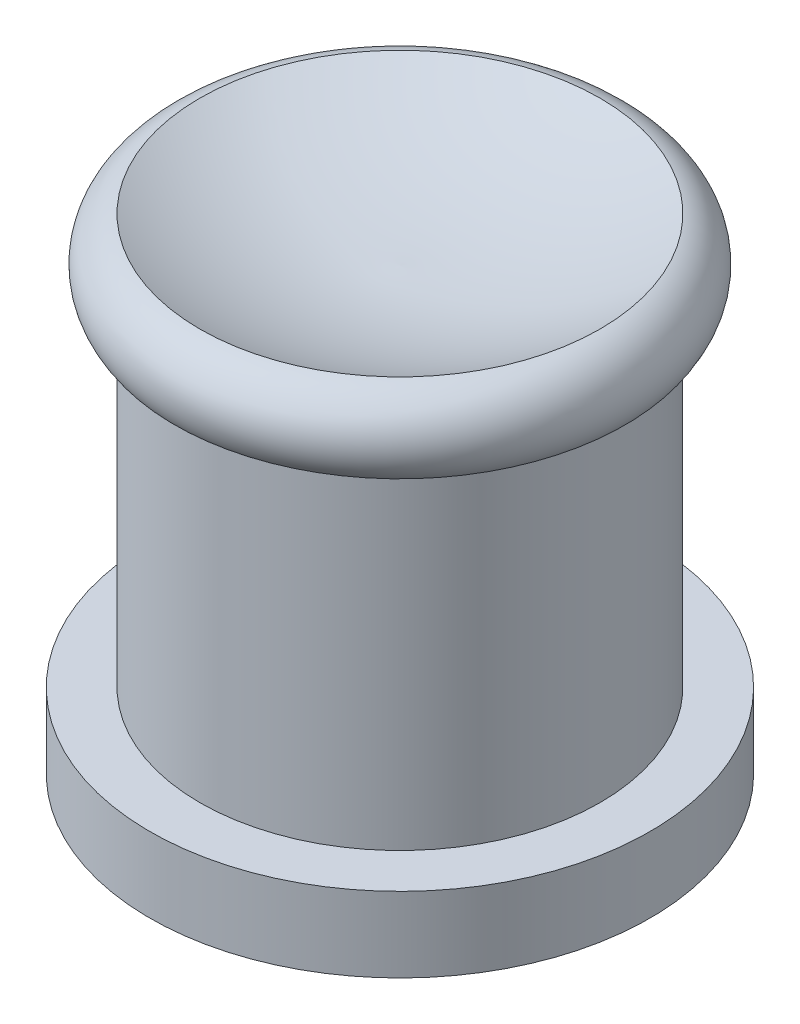
from build123d import *


with BuildPart() as part:
    # Sketch1 → Revolve1 (revolve)
    with BuildSketch(Plane.XY, mode=Mode.PRIVATE) as revolve1_sk:
        with BuildLine():
            Line((0, 0), (0, 0.8))
            Line((0, 0.8), (0, 0.88))
            ThreePointArc((0, 0.88), (0.205863515, 0.898939934), (0.4, 0.97))
            ThreePointArc((0.4, 0.97), (0.462747108, 0.912806691), (0.45, 0.828867513))
            Line((0.45, 0.828867513), (0.4, 0.8))
            Line((0.4, 0.8), (0.4, 0.15))
            Line((0.4, 0.15), (0.5, 0.15))
            Line((0.5, 0.15), (0.5, 0))
            Line((0.5, 0), (0, 0))
        make_face()
    revolve(revolve1_sk.sketch.rotate(Axis((0, 0.88, 0), (0, -1, 0)), 180), axis=Axis((0, 0.88, 0), (0, -1, 0)))


solid = part.part
